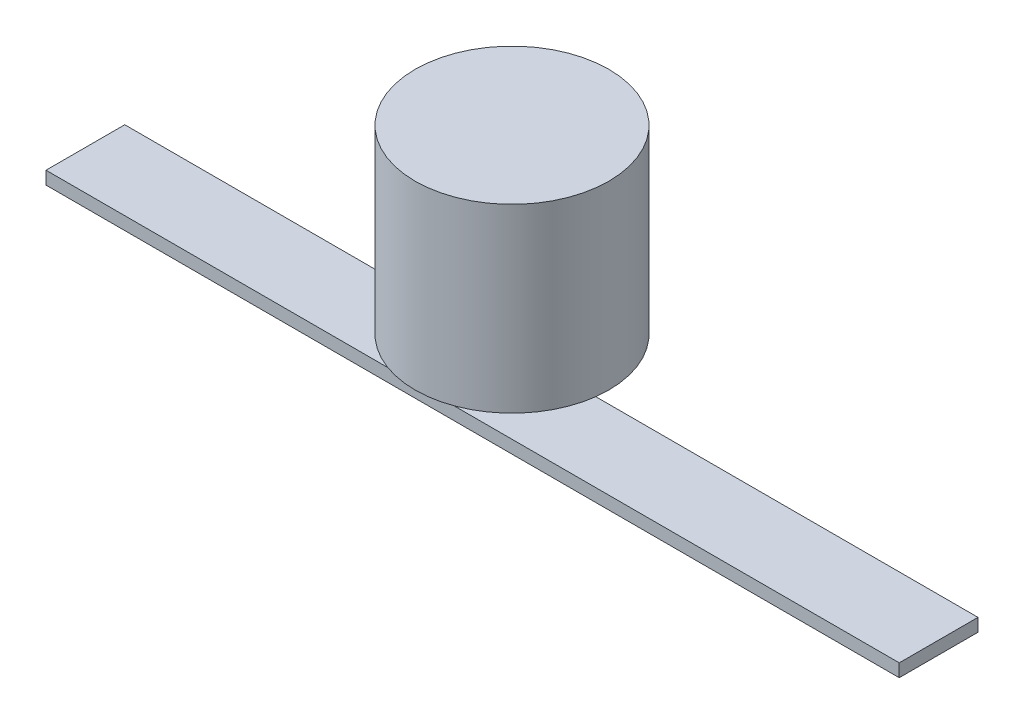
from build123d import *

# Parameters (mm, degrees)
SKETCH1_W           = 330.2
SKETCH1_H           = 30.48
BOSS_EXTRUDE1_DEPTH = 5
SKETCH2_R           = 7.5
BOSS_EXTRUDE2_DEPTH = 20
SKETCH3_R           = 37.5
BOSS_EXTRUDE3_DEPTH = 70


with BuildPart() as part:
    # Sketch1 → Boss-Extrude1 (new body)
    with BuildSketch(Plane(origin=(0, 0, 0), x_dir=(1, 0, 0), z_dir=(0, 1, 0))):
        Rectangle(SKETCH1_W, SKETCH1_H)
    extrude(amount=BOSS_EXTRUDE1_DEPTH)

    # Sketch2 → Boss-Extrude2 (add)
    with BuildSketch(Plane(origin=(0, 5, 0), x_dir=(1, 0, 0), z_dir=(0, 1, 0))):
        with Locations(Location((0, 0, 0), (0, 0, 90))):
            Circle(SKETCH2_R)
    extrude(amount=BOSS_EXTRUDE2_DEPTH)

    # Sketch3 → Boss-Extrude3 (add)
    with BuildSketch(Plane(origin=(0, 25, 0), x_dir=(1, 0, 0), z_dir=(0, 1, 0))):
        with Locations(Location((0, 0, 0), (0, 0, 270))):
            Circle(SKETCH3_R)
    extrude(amount=BOSS_EXTRUDE3_DEPTH)


solid = part.part
